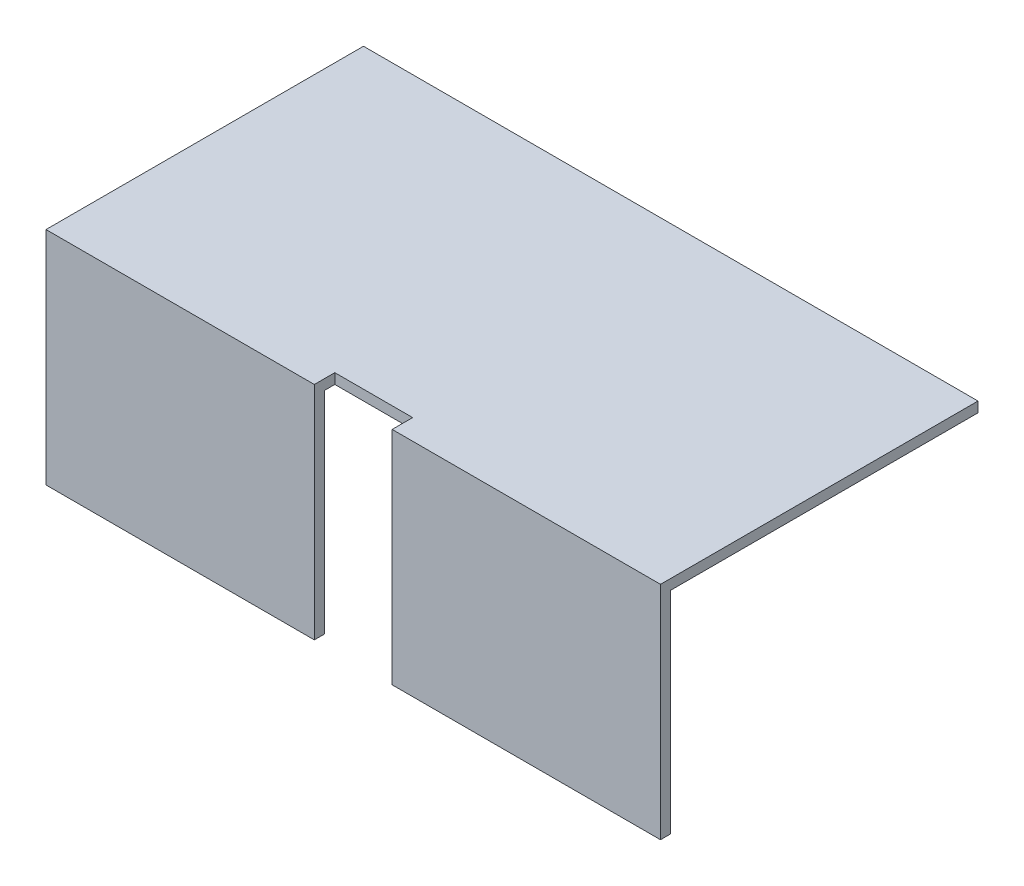
from build123d import *

# Parameters (mm, degrees)
EXTRUDE_THIN1_DEPTH = 300
SKETCH2_W           = 38
SKETCH2_H           = 10
CUT_EXTRUDE1_DEPTH  = 130


with BuildPart() as part:
    # Sketch1 → Extrude-Thin1 (new body)
    with BuildSketch(Plane(origin=(0, 0, 0), x_dir=(0, 0, -1), z_dir=(1, 0, 0))):
        Polygon((0, 0), (-150, 0), (-150, -103), (-155, -103), (-155, 5), (0, 5), align=None)
    extrude(amount=EXTRUDE_THIN1_DEPTH)

    # Sketch2 → Cut-Extrude1 (cut)
    with BuildSketch(Plane(origin=(0, 5, 0), x_dir=(1, 0, 0), z_dir=(0, 1, 0))):
        with Locations((150, -150)):
            Rectangle(SKETCH2_W, SKETCH2_H)
    extrude(amount=-CUT_EXTRUDE1_DEPTH, mode=Mode.SUBTRACT)


solid = part.part
